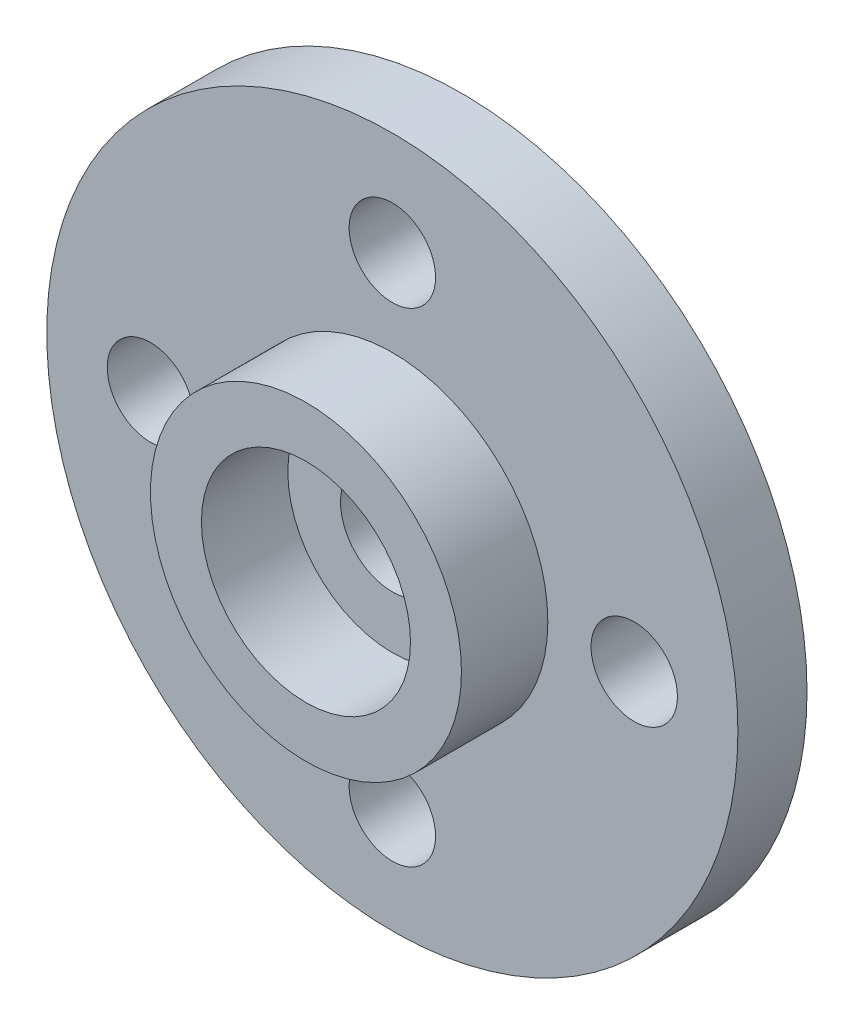
from build123d import *

# Parameters (mm, degrees)
SKETCH1_R             = 10
SKETCH1_R_2           = 0.5
BOSS_EXTRUDE1_DEPTH   = 2
M3X0_5_TAPPED_HOLE2_D = 2.5
M3X0_5_TAPPED_HOLE3_D = 2.5
M3X0_5_TAPPED_HOLE4_D = 2.5
M3X0_5_TAPPED_HOLE5_D = 2.5
SKETCH11_R            = 4.5
SKETCH11_R_2          = 3.025
BOSS_EXTRUDE2_DEPTH   = 2.5


with BuildPart() as part:
    # Sketch1 → Boss-Extrude1 (new body)
    with BuildSketch(Plane.XY):
        Circle(SKETCH1_R)
        with BuildLine():
            ThreePointArc((0.5, -7), (-0.353553391, -7.353553391), (0, -6.5))
            ThreePointArc((0, -6.5), (0.353553391, -6.646446609), (0.5, -7))
        make_face(mode=Mode.SUBTRACT)
        with Locations((-7, 0)):
            Circle(SKETCH1_R_2, mode=Mode.SUBTRACT)
        with BuildLine():
            ThreePointArc((1.5, 0), (1.060660172, -1.060660172), (0, -1.5))
            ThreePointArc((0, -1.5), (-1.060660172, -1.060660172), (-1.5, 0))
            ThreePointArc((-1.5, 0), (-1.060660172, 1.060660172), (0, 1.5))
            ThreePointArc((0, 1.5), (1.060660172, 1.060660172), (1.5, 0))
        make_face(mode=Mode.SUBTRACT)
        with BuildLine():
            ThreePointArc((7.5, 0), (7, -0.5), (6.5, 0))
            ThreePointArc((6.5, 0), (7, 0.5), (7.5, 0))
        make_face(mode=Mode.SUBTRACT)
        with BuildLine():
            ThreePointArc((0.5, 7), (0.353553391, 6.646446609), (0, 6.5))
            ThreePointArc((0, 6.5), (-0.353553391, 7.353553391), (0.5, 7))
        make_face(mode=Mode.SUBTRACT)
    extrude(amount=BOSS_EXTRUDE1_DEPTH)

    # M3x0.5 Tapped Hole2 (through all)
    with Locations(Plane(origin=(0, 7, 2), x_dir=(1, 0, 0), z_dir=(0, 0, 1))):
        with Locations((0, 0)):
            Hole(M3X0_5_TAPPED_HOLE2_D / 2)

    # M3x0.5 Tapped Hole3 (through all)
    with Locations(Plane.XY.offset(2)):
        with Locations((-7, 0)):
            Hole(M3X0_5_TAPPED_HOLE3_D / 2)

    # M3x0.5 Tapped Hole4 (through all)
    with Locations(Plane.XY.offset(2)):
        with Locations((0, -7)):
            Hole(M3X0_5_TAPPED_HOLE4_D / 2)

    # M3x0.5 Tapped Hole5 (through all)
    with Locations(Plane.XY.offset(2)):
        with Locations((7, 0)):
            Hole(M3X0_5_TAPPED_HOLE5_D / 2)

    # Sketch11 → Boss-Extrude2 (add)
    with BuildSketch(Plane.XY.offset(2)):
        Circle(SKETCH11_R)
        Circle(SKETCH11_R_2, mode=Mode.SUBTRACT)
    extrude(amount=BOSS_EXTRUDE2_DEPTH)


solid = part.part
